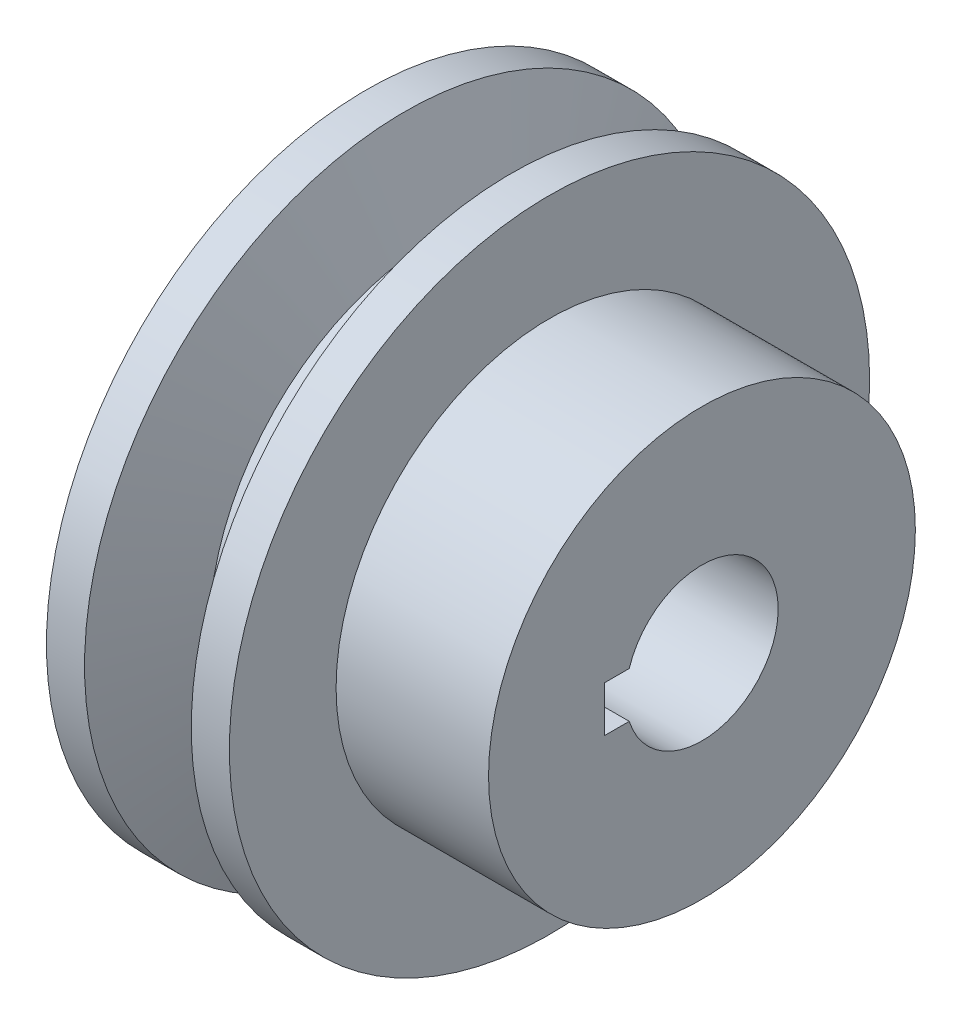
from build123d import *

# Parameters (mm, degrees)
CUT_EXTRUDE1_DEPTH = 37.959437225


with BuildPart() as part:
    # Sketch1 → Revolve1 (revolve)
    with BuildSketch(Plane.XY, mode=Mode.PRIVATE) as revolve1_sk:
        Polygon((22, 0), (0, 0), (0, 21), (2.5, 21), (4.683821406, 15), (7.316178594, 15), (9.5, 21), (12, 21), (12, 14), (22, 14), align=None)
    revolve(revolve1_sk.sketch.rotate(Axis((22, 0, 0), (-1, 0, 0)), 90), axis=Axis((22, 0, 0), (-1, 0, 0)))

    # Sketch2 → Cut-Extrude1 (cut, through all)
    with BuildSketch(Plane.ZY):
        with BuildLine():
            Line((6.4, 1.5), (6.4, -1.5))
            Line((6.4, -1.5), (4.769696007, -1.5))
            ThreePointArc((4.769696007, -1.5), (-5, 0), (4.769696007, 1.5))
            Line((4.769696007, 1.5), (6.4, 1.5))
        make_face()
    extrude(amount=-CUT_EXTRUDE1_DEPTH, mode=Mode.SUBTRACT)


solid = part.part
